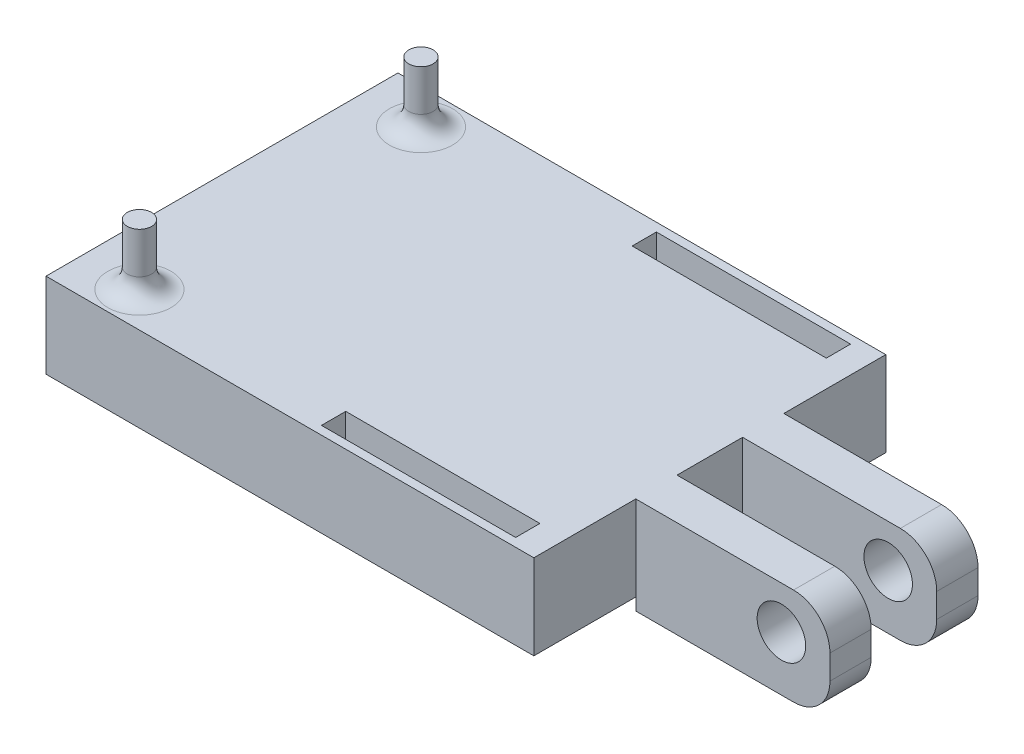
from build123d import *

# Parameters (mm, degrees)
SKETCH1_W               = 50.8
SKETCH1_H               = 36.83
BOSS_EXTRUDE1_DEPTH     = 8.89
SKETCH2_W               = 36.83
SKETCH2_H               = 8.89
BOSS_EXTRUDE2_DEPTH     = 0.254
SKETCH3_W               = 4.318
SKETCH3_H               = 10.16
BOSS_EXTRUDE3_DEPTH     = 20.32
CUT_EXTRUDE1_DEPTH      = 54.86357322
CUT_EXTRUDE1_DEPTH_BACK = 54.86357322
SKETCH4_R               = 2.54
FILLET1_R               = 3.81
SKETCH18_5_W            = 20.32
SKETCH18_5_H            = 2.54
CUT_EXTRUDE2_DEPTH      = 51.556369539
SKETCH7_W               = 20.32
SKETCH7_H               = 2.54
CUT_EXTRUDE3_DEPTH      = 51.556369539
SKETCH18_16_R           = 1.27
BOSS_EXTRUDE4_DEPTH     = 6.35
FILLET2_R               = 2.032


with BuildPart() as part:
    # Sketch1 → Boss-Extrude1 (new body)
    with BuildSketch(Plane(origin=(0, 0, 0), x_dir=(1, 0, 0), z_dir=(0, 1, 0))):
        Rectangle(SKETCH1_W, SKETCH1_H)
    extrude(amount=-BOSS_EXTRUDE1_DEPTH)

    # Sketch2 → Boss-Extrude2 (add)
    with BuildSketch(Plane(origin=(25.4, 0, 0), x_dir=(0, 0, -1), z_dir=(1, 0, 0))):
        with Locations((0, -4.445)):
            Rectangle(SKETCH2_W, SKETCH2_H)
    extrude(amount=BOSS_EXTRUDE2_DEPTH)

    # Sketch3 → Boss-Extrude3 (add)
    with BuildSketch(Plane(origin=(25.654, 0, 0), x_dir=(0, 0, -1), z_dir=(1, 0, 0))):
        with Locations((-5.588, -5.08)):
            Rectangle(SKETCH3_W, SKETCH3_H)
        with Locations((5.588, -5.08)):
            Rectangle(SKETCH3_W, SKETCH3_H)
    extrude(amount=BOSS_EXTRUDE3_DEPTH)

    # Sketch4 → Cut-Extrude1 (cut, two sides: drawn at the far end of the back side and taken through both)
    with BuildSketch(Plane(origin=(0, 0, -7.747), x_dir=(-1, 0, 0), z_dir=(0, 0, -1)).offset(-CUT_EXTRUDE1_DEPTH_BACK)):
        with Locations((-40.894, -4.445)):
            Circle(SKETCH4_R)
    extrude(amount=CUT_EXTRUDE1_DEPTH + CUT_EXTRUDE1_DEPTH_BACK, mode=Mode.SUBTRACT)

    # Fillet1
    fillet1_edges = [part.edges().sort_by_distance(p)[0] for p in [
        (45.974, 0, 5.588),
        (45.974, -10.16, 5.588),
        (45.974, 0, -5.588),
        (45.974, -10.16, -5.588),
    ]]
    fillet(fillet1_edges, radius=FILLET1_R)

    # Sketch18<5> → Cut-Extrude2 (cut, through all)
    with BuildSketch(Plane(origin=(0, 0, 0), x_dir=(1, 0, 0), z_dir=(0, 1, 0))):
        with Locations((12.7, 16.256)):
            Rectangle(SKETCH18_5_W, SKETCH18_5_H)
    extrude(amount=-CUT_EXTRUDE2_DEPTH, mode=Mode.SUBTRACT)

    # Sketch7 → Cut-Extrude3 (cut, through all)
    with BuildSketch(Plane(origin=(0, 0, 0), x_dir=(1, 0, 0), z_dir=(0, 1, 0))):
        with Locations((12.7, -16.256)):
            Rectangle(SKETCH7_W, SKETCH7_H)
    extrude(amount=-CUT_EXTRUDE3_DEPTH, mode=Mode.SUBTRACT)

    # Sketch18<16> → Boss-Extrude4 (add)
    with BuildSketch(Plane(origin=(0, 0, 0), x_dir=(1, 0, 0), z_dir=(0, 1, 0))):
        with Locations((-19.304, -14.732)):
            Circle(SKETCH18_16_R)
        with Locations((-19.304, 14.732)):
            Circle(SKETCH18_16_R)
    extrude(amount=BOSS_EXTRUDE4_DEPTH)

    # Fillet2
    fillet2_edges = [part.edges().sort_by_distance(p)[0] for p in [
        (-20.574, 0, -14.732),
        (-20.574, 0, 14.732),
    ]]
    fillet(fillet2_edges, radius=FILLET2_R)


solid = part.part
